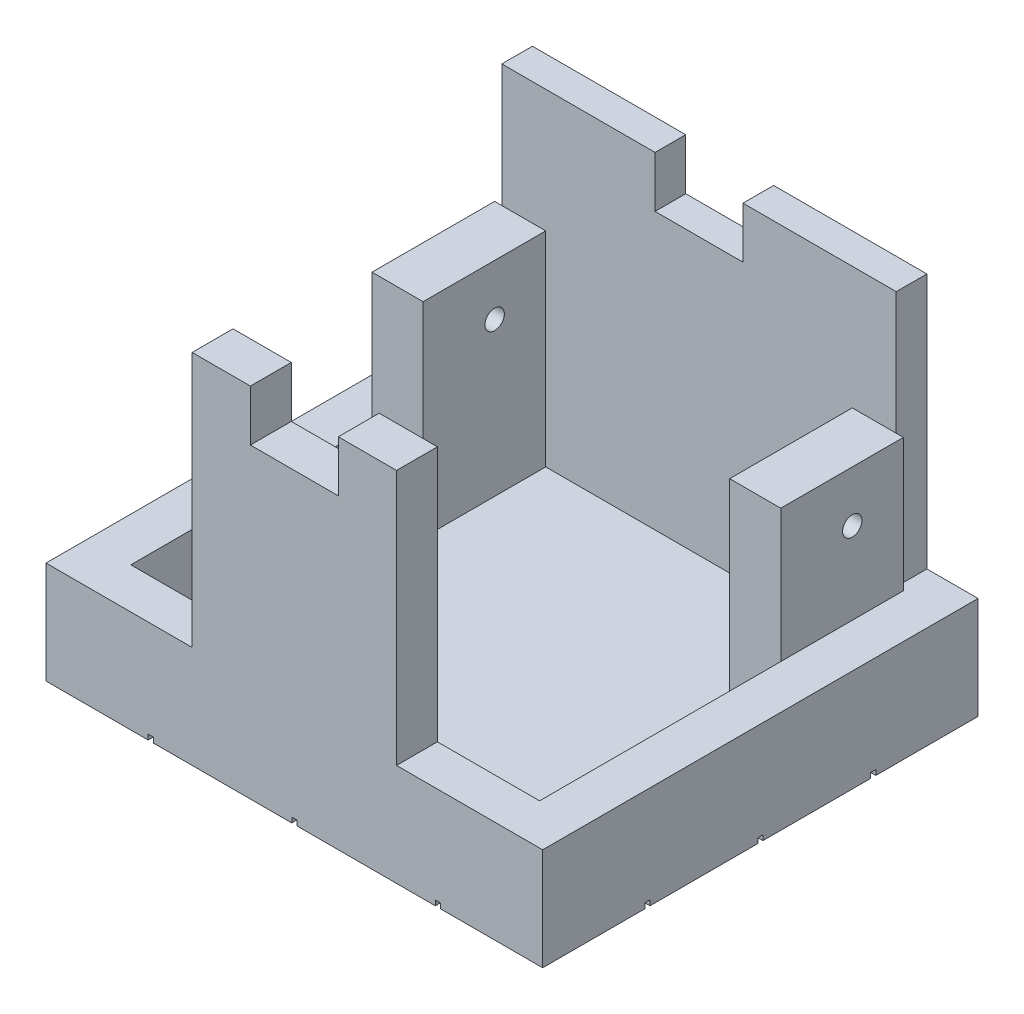
from build123d import *

# Parameters (mm, degrees)
SKETCH_1_W          = 48.6
SKETCH_1_H          = 42.6
EXTRUDE_1_DEPTH     = 3
SKETCH_2_W          = 48.6
SKETCH_2_H          = 42.6
SKETCH_2_W_2        = 40
SKETCH_2_H_2        = 35.6
EXTRUDE_2_DEPTH     = 7
SKETCH_3_W          = 20
SKETCH_3_H          = 4
SKETCH_3_W_2        = 38.6
SKETCH_3_H_2        = 3
EXTRUDE_3_DEPTH     = 20
SKETCH_6_W          = 15
SKETCH_6_H          = 3
SKETCH_6_W_2        = 5.7
SKETCH_6_H_2        = 4
EXTRUDE_4_DEPTH     = 5
SKETCH_7_W          = 5
SKETCH_7_H          = 12
EXTRUDE_5_DEPTH     = 20
SKETCH_8_R          = 0.95
CUT_EXTRUDE_1_DEPTH = 64.566107321
SKETCH_9_W          = 48.6
SKETCH_9_H          = 0.5
CUT_EXTRUDE_2_DEPTH = 0.5
SKETCH_10_W         = 0.5
SKETCH_10_H         = 42.6
CUT_EXTRUDE_3_DEPTH = 0.5


with BuildPart() as part:
    # 草图1 → 凸台-拉伸1 (new body)
    with BuildSketch(Plane(origin=(0, 0, 0), x_dir=(1, 0, 0), z_dir=(0, 1, 0))):
        Rectangle(SKETCH_1_W, SKETCH_1_H)
    extrude(amount=EXTRUDE_1_DEPTH)

    # 草图2 → 凸台-拉伸2 (add)
    with BuildSketch(Plane(origin=(0, 3, 0), x_dir=(1, 0, 0), z_dir=(0, 1, 0))):
        Rectangle(SKETCH_2_W, SKETCH_2_H)
        with Locations((0, 0.5)):
            Rectangle(SKETCH_2_W_2, SKETCH_2_H_2, mode=Mode.SUBTRACT)
    extrude(amount=EXTRUDE_2_DEPTH)

    # 草图3 → 凸台-拉伸3 (add)
    with BuildSketch(Plane(origin=(0, 10, 0), x_dir=(1, 0, 0), z_dir=(0, 1, 0))):
        with Locations((0, -19.3)):
            Rectangle(SKETCH_3_W, SKETCH_3_H)
        with Locations((0, 19.8)):
            Rectangle(SKETCH_3_W_2, SKETCH_3_H_2)
    extrude(amount=EXTRUDE_3_DEPTH)

    # 草图6 → 凸台-拉伸4 (add)
    with BuildSketch(Plane(origin=(0, 30, 0), x_dir=(1, 0, 0), z_dir=(0, 1, 0))):
        with Locations((-11.8, 19.8)):
            Rectangle(SKETCH_6_W, SKETCH_6_H)
        with Locations((11.8, 19.8)):
            Rectangle(SKETCH_6_W, SKETCH_6_H)
        with Locations((-7.15, -19.3)):
            Rectangle(SKETCH_6_W_2, SKETCH_6_H_2)
        with Locations((7.15, -19.3)):
            Rectangle(SKETCH_6_W_2, SKETCH_6_H_2)
    extrude(amount=EXTRUDE_4_DEPTH)

    # 草图7 → 凸台-拉伸5 (add)
    with BuildSketch(Plane(origin=(0, 3, 0), x_dir=(1, 0, 0), z_dir=(0, 1, 0))):
        with Locations((17.5, 12.3)):
            Rectangle(SKETCH_7_W, SKETCH_7_H)
        with Locations((-17.5, 12.3)):
            Rectangle(SKETCH_7_W, SKETCH_7_H)
    extrude(amount=EXTRUDE_5_DEPTH)

    # 草图8 → 切除-拉伸1 (cut, through all)
    with BuildSketch(Plane(origin=(24.3, 0, 0), x_dir=(0, 0, -1), z_dir=(1, 0, 0))):
        with Locations((13.3, 18)):
            Circle(SKETCH_8_R)
    extrude(amount=-CUT_EXTRUDE_1_DEPTH, mode=Mode.SUBTRACT)

    # 草图9 → 切除-拉伸2 (cut)
    with BuildSketch(Plane.XZ):
        with Locations((0, 11.05)):
            Rectangle(SKETCH_9_W, SKETCH_9_H)
        with Locations((0, -11.05)):
            Rectangle(SKETCH_9_W, SKETCH_9_H)
        Rectangle(SKETCH_9_W, SKETCH_9_H)
    extrude(amount=-CUT_EXTRUDE_2_DEPTH, mode=Mode.SUBTRACT)

    # 草图10 → 切除-拉伸3 (cut)
    with BuildSketch(Plane.XZ):
        Rectangle(SKETCH_10_W, SKETCH_10_H)
        with Locations((-14.05, 0)):
            Rectangle(SKETCH_10_W, SKETCH_10_H)
        with Locations((14.05, 0)):
            Rectangle(SKETCH_10_W, SKETCH_10_H)
    extrude(amount=-CUT_EXTRUDE_3_DEPTH, mode=Mode.SUBTRACT)


solid = part.part
